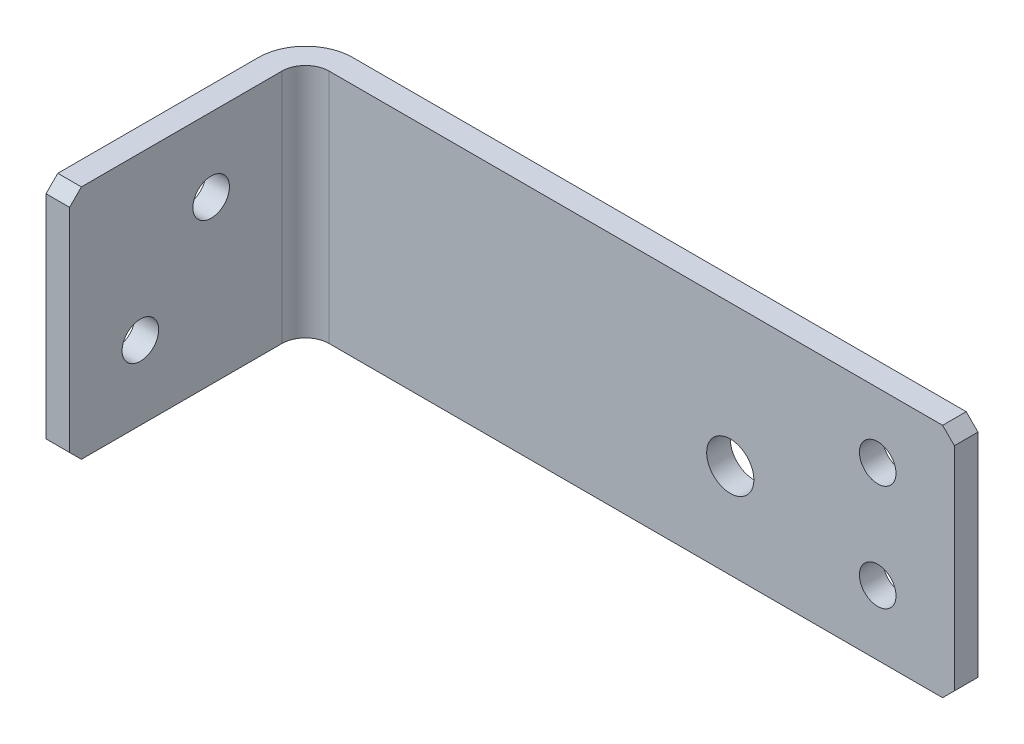
from build123d import *

# Parameters (mm, degrees)
BASE_DEPTH           = 20
SKETCH2_R            = 1.55
GUIDESIDEHOLES_DEPTH = 20
SKETCH3_R            = 1.55
FOOTSIDEHOLES_DEPTH  = 63.521996129
CHAMFER1_SIZE        = 1
SKETCH4_R            = 2
CABLETIEHOLE_DEPTH   = 63.521996129


with BuildPart() as part:
    # Sketch1 → Base (new body)
    with BuildSketch(Plane(origin=(0, 0, 0), x_dir=(1, 0, 0), z_dir=(0, 1, 0))):
        with BuildLine():
            Line((0, 0), (0, 18))
            ThreePointArc((0, 18), (0.585786438, 19.414213562), (2, 20))
            Line((2, 20), (55, 20))
            Line((55, 20), (55, 22))
            Line((55, 22), (2, 22))
            ThreePointArc((2, 22), (-0.828427125, 20.828427125), (-2, 18))
            Line((-2, 18), (-2, 0))
            Line((-2, 0), (0, 0))
        make_face()
    extrude(amount=BASE_DEPTH)

    # Sketch2 → GuideSideHoles (cut)
    with BuildSketch(Plane.ZY.offset(2)):
        with Locations((-12, 13.75)):
            Circle(SKETCH2_R)
        with Locations((-6, 6.25)):
            Circle(SKETCH2_R)
    extrude(amount=-GUIDESIDEHOLES_DEPTH, mode=Mode.SUBTRACT)

    # Sketch3 → FootSideHoles (cut, through all)
    with BuildSketch(Plane(origin=(0, 0, -22), x_dir=(-1, 0, 0), z_dir=(0, 0, -1))):
        with Locations((-48.5, 14.5)):
            Circle(SKETCH3_R)
        with Locations((-48.5, 5.5)):
            Circle(SKETCH3_R)
    extrude(amount=-FOOTSIDEHOLES_DEPTH, mode=Mode.SUBTRACT)

    # Chamfer1
    chamfer1_edges = [part.edges().sort_by_distance(p)[0] for p in [
        (-1, 0, 0),
        (55, 0, -21),
        (-1, 20, 0),
        (55, 20, -21),
    ]]
    chamfer(chamfer1_edges, length=CHAMFER1_SIZE)

    # Sketch4 → CableTieHole (cut, through all)
    with BuildSketch(Plane(origin=(0, 0, -22), x_dir=(-1, 0, 0), z_dir=(0, 0, -1))):
        with Locations((-36, 8)):
            Circle(SKETCH4_R)
    extrude(amount=-CABLETIEHOLE_DEPTH, mode=Mode.SUBTRACT)


solid = part.part
